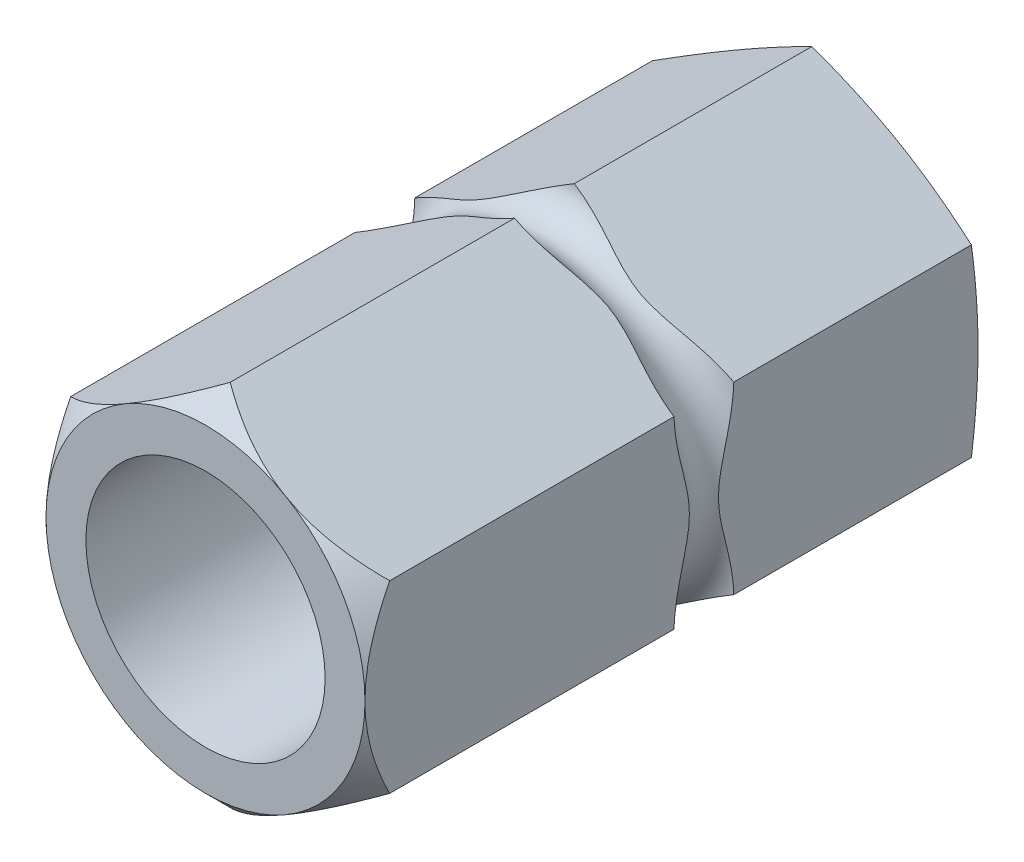
from build123d import *

# Parameters (mm, degrees)
SKETCH1_R          = 9.525
EXTRUDE1_DEPTH     = 59
SKETCH2_R          = 2.38125
SKETCH3_W          = 35.382303839
SKETCH3_H          = 29.228859692
CUT_EXTRUDE1_DEPTH = 10


with BuildPart() as part:
    # Sketch1 → Extrude1 (new body)
    with BuildSketch(Plane.XY):
        Polygon((-12.7, 7.332348419), (-12.7, -7.332348419), (0, -14.664696837), (12.7, -7.332348419), (12.7, 7.332348419), (0, 14.664696837), align=None)
        Circle(SKETCH1_R, mode=Mode.SUBTRACT)
    extrude(amount=-EXTRUDE1_DEPTH)

    # Sketch2 → Cut-Revolve3 (revolve, cut)
    with BuildSketch(Plane(origin=(0, 0, 0), x_dir=(0, 0, -1), z_dir=(1, 0, 0)), mode=Mode.PRIVATE) as cut_revolve3_sk:
        Polygon((59, 14.664696837), (48.285996634, 14.664696837), (49, 12), (59, 12), align=None)
        Polygon((1.964696837, 14.664696837), (0, 14.664696837), (0, 12.7), align=None)
        with Locations((26.9875, 14.78125)):
            Circle(SKETCH2_R)
    revolve(cut_revolve3_sk.sketch.rotate(Axis((0, 0, 0), (0, 0, -1)), 90), axis=Axis((0, 0, 0), (0, 0, -1)), mode=Mode.SUBTRACT)

    # Sketch3 → Cut-Extrude1 (cut)
    with BuildSketch(Plane(origin=(0, 0, -59), x_dir=(-1, 0, 0), z_dir=(0, 0, -1))):
        with Locations((2.307541554, -0.133770525)):
            Rectangle(SKETCH3_W, SKETCH3_H)
    extrude(amount=-CUT_EXTRUDE1_DEPTH, mode=Mode.SUBTRACT)


solid = part.part
